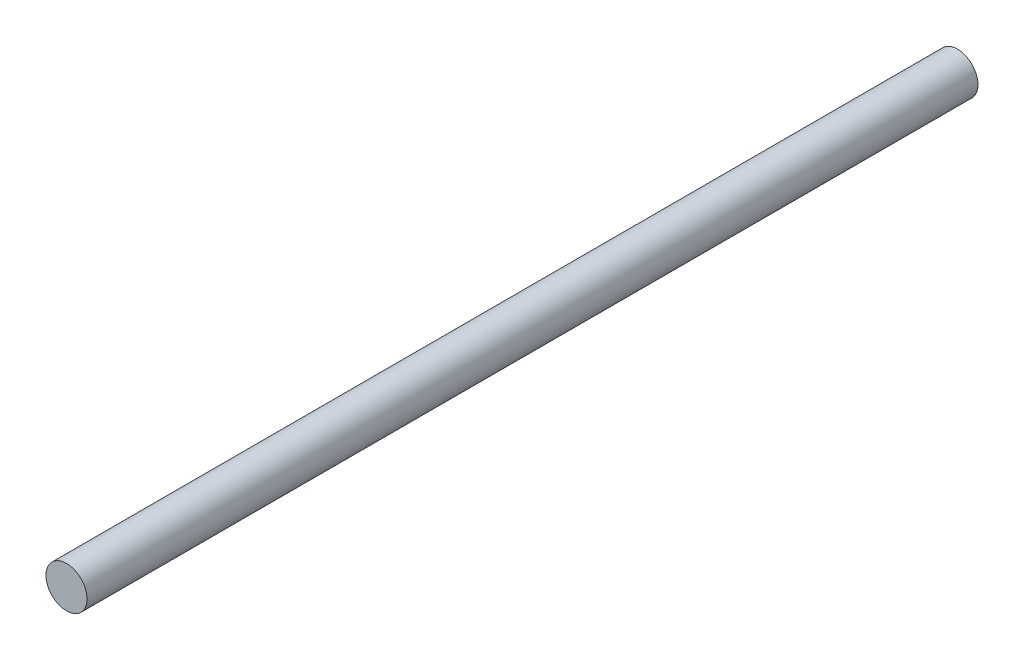
from build123d import *

# Parameters (mm, degrees)
SKETCH_1_R      = 3
EXTRUDE_1_DEPTH = 130


with BuildPart() as part:
    # 草图1 → 凸台-拉伸1 (new body)
    with BuildSketch(Plane.XY):
        Circle(SKETCH_1_R)
    extrude(amount=EXTRUDE_1_DEPTH)


solid = part.part
